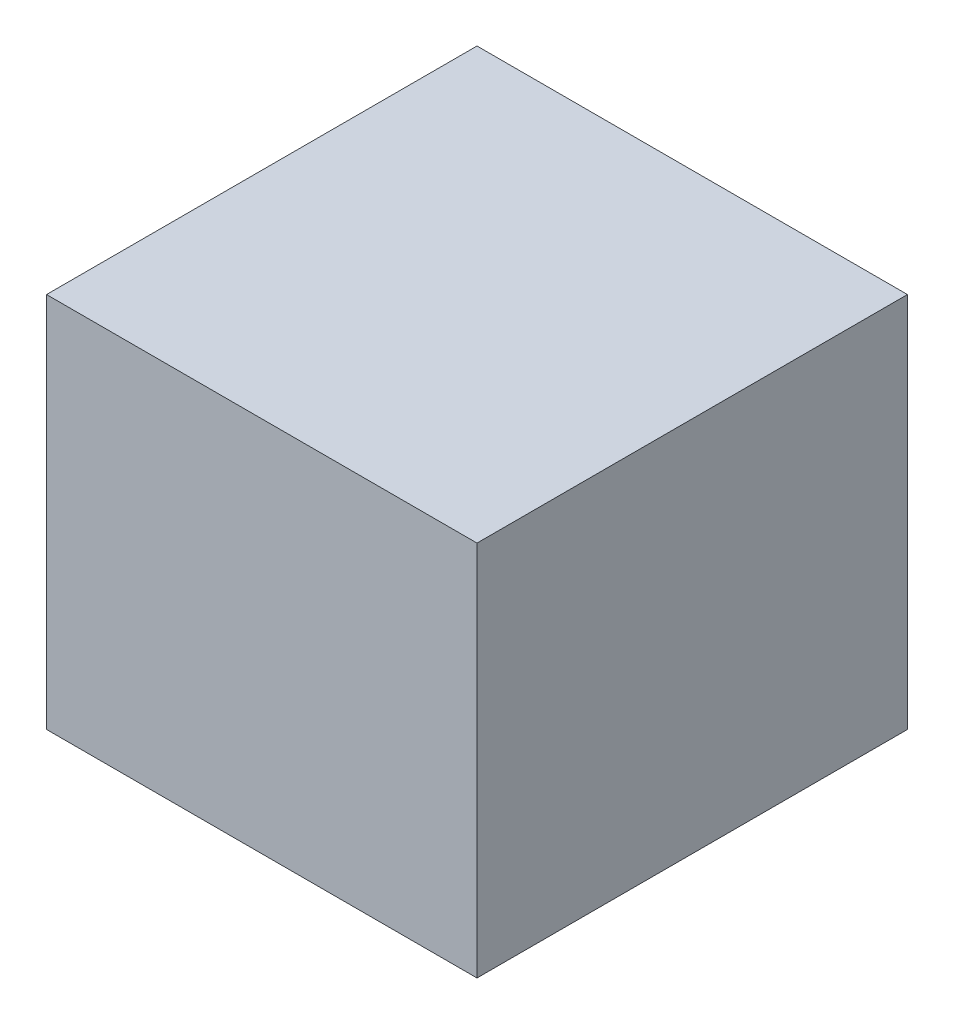
from build123d import *

# Parameters (mm, degrees)
SKETCH1_W           = 400
SKETCH1_H           = 350
BOSS_EXTRUDE1_DEPTH = 400


with BuildPart() as part:
    # Sketch1 → Boss-Extrude1 (new body)
    with BuildSketch(Plane.XY):
        with Locations((200, 175)):
            Rectangle(SKETCH1_W, SKETCH1_H)
    extrude(amount=BOSS_EXTRUDE1_DEPTH)


solid = part.part
